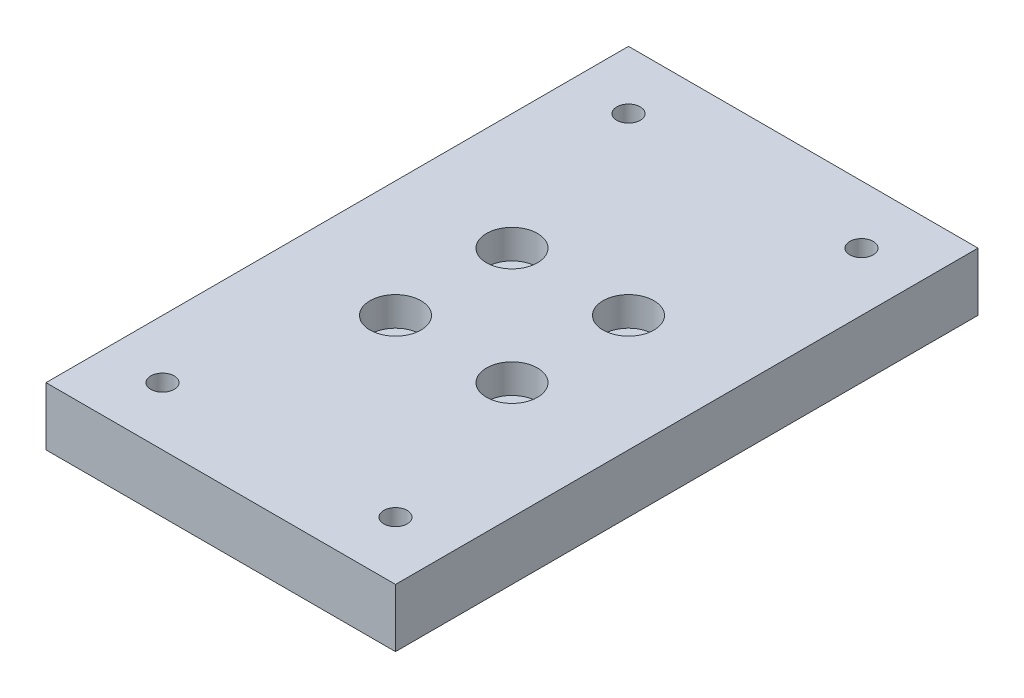
from build123d import *

# Parameters (mm, degrees)
SKETCH1_W                                        = 76.2
SKETCH1_H                                        = 127
SKETCH1_R                                        = 3.429
BOSS_EXTRUDE1_DEPTH                              = 12.7
CBORE_FOR_1_4_SOCKET_HEAD_CAP_SCREW1_D           = 6.7564
CBORE_FOR_1_4_SOCKET_HEAD_CAP_SCREW1_CBORE_D     = 11.1125
CBORE_FOR_1_4_SOCKET_HEAD_CAP_SCREW1_CBORE_DEPTH = 6.35
F_1_4_20_TAPPED_HOLE1_D                          = 5.1054


with BuildPart() as part:
    # Sketch1 → Boss-Extrude1 (new body)
    with BuildSketch(Plane(origin=(0, 0, 0), x_dir=(1, 0, 0), z_dir=(0, 1, 0))):
        Rectangle(SKETCH1_W, SKETCH1_H)
        with Locations(Location((-12.7, 12.7, 0), (0, 0, 270))):
            Circle(SKETCH1_R, mode=Mode.SUBTRACT)
        with Locations(Location((12.7, 12.7, 0), (0, 0, 270))):
            Circle(SKETCH1_R, mode=Mode.SUBTRACT)
        with Locations(Location((12.7, -12.7, 0), (0, 0, 270))):
            Circle(SKETCH1_R, mode=Mode.SUBTRACT)
        with Locations(Location((-12.7, -12.7, 0), (0, 0, 270))):
            Circle(SKETCH1_R, mode=Mode.SUBTRACT)
    extrude(amount=BOSS_EXTRUDE1_DEPTH)

    # CBORE for 1/4 Socket Head Cap Screw1 (through all)
    with Locations(Plane(origin=(0, 12.7, 0), x_dir=(1, 0, 0), z_dir=(0, 1, 0))):
        with Locations((-12.7, 12.7), (12.7, 12.7), (12.7, -12.7), (-12.7, -12.7), (-108.226831433, 58.259256328)):
            CounterBoreHole(CBORE_FOR_1_4_SOCKET_HEAD_CAP_SCREW1_D / 2, CBORE_FOR_1_4_SOCKET_HEAD_CAP_SCREW1_CBORE_D / 2, CBORE_FOR_1_4_SOCKET_HEAD_CAP_SCREW1_CBORE_DEPTH)

    # 1/4-20 Tapped Hole1 (through all)
    with Locations(Plane(origin=(0, 12.7, 0), x_dir=(1, 0, 0), z_dir=(0, 1, 0))):
        with Locations((25.4, 50.8), (-25.4, 50.8), (-25.4, -50.8), (25.4, -50.8)):
            Hole(F_1_4_20_TAPPED_HOLE1_D / 2)


solid = part.part
